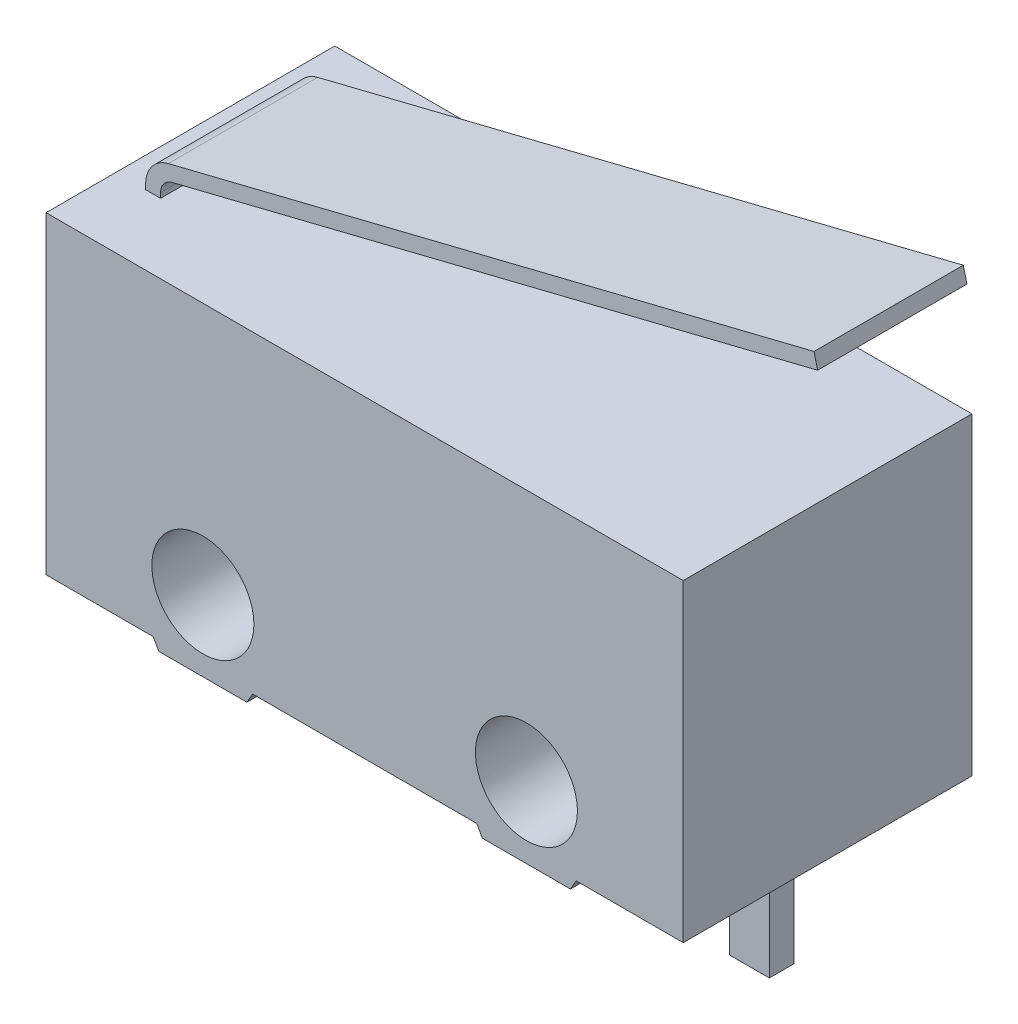
from build123d import *

# Parameters (mm, degrees)
SKETCH1_W           = 12.8
SKETCH1_H           = 5.8
BOSS_EXTRUDE1_DEPTH = 6.5
SKETCH2_R           = 1.025
CUT_EXTRUDE1_DEPTH  = 11.80971785
SKETCH3_W           = 0.8
SKETCH3_H           = 0.5
BOSS_EXTRUDE2_DEPTH = 2.4
BOSS_EXTRUDE3_DEPTH = 1.5


with BuildPart() as part:
    # Sketch1 → Boss-Extrude1 (new body)
    with BuildSketch(Plane(origin=(0, 0, 0), x_dir=(1, 0, 0), z_dir=(0, 1, 0))):
        Rectangle(SKETCH1_W, SKETCH1_H)
    extrude(amount=BOSS_EXTRUDE1_DEPTH)

    # Sketch2 → Cut-Extrude1 (cut, through all)
    with BuildSketch(Plane.XY.offset(2.9)):
        with Locations((-3.25, 1.425)):
            Circle(SKETCH2_R)
        with Locations((3.25, 1.425)):
            Circle(SKETCH2_R)
        Polygon((-6.4, 0.2), (-4.25, 0.2), (-4.134529946, 0), (-6.4, 0), align=None)
        Polygon((4.134529946, 0), (6.4, 0), (6.4, 0.2), (4.25, 0.2), align=None)
        Polygon((2.365470054, 0), (2.25, 0.2), (-2.25, 0.2), (-2.365470054, 0), align=None)
    extrude(amount=-CUT_EXTRUDE1_DEPTH, mode=Mode.SUBTRACT)

    # Sketch3 → Boss-Extrude2 (add)
    with BuildSketch(Plane.XZ.offset(-0.2)):
        Rectangle(SKETCH3_W, SKETCH3_H)
        with Locations((5.08, 0)):
            Rectangle(SKETCH3_W, SKETCH3_H)
        with Locations((-5.08, 0)):
            Rectangle(SKETCH3_W, SKETCH3_H)
    extrude(amount=BOSS_EXTRUDE2_DEPTH)

    # Sketch4 → Boss-Extrude3 (add, symmetric)
    with BuildSketch(Plane.XY):
        with BuildLine():
            Line((-5.8, 6.5), (-5.8, 6.6))
            ThreePointArc((-5.8, 6.6), (-5.672582553, 6.969683285), (-5.344447564, 7.182352901))
            Line((-5.344447564, 7.182352901), (7.627776218, 10.4))
            Line((7.627776218, 10.4), (7.7, 10.108823549))
            Line((7.7, 10.108823549), (-5.272223782, 6.891176451))
            ThreePointArc((-5.272223782, 6.891176451), (-5.436291276, 6.784841642), (-5.5, 6.6))
            Line((-5.5, 6.6), (-5.5, 6.5))
            Line((-5.5, 6.5), (-5.8, 6.5))
        make_face()
    extrude(amount=BOSS_EXTRUDE3_DEPTH, both=True)


solid = part.part
